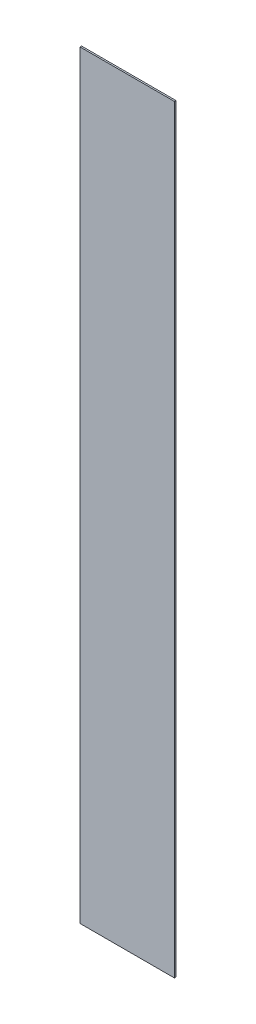
from build123d import *

# Parameters (mm, degrees)
SKETCH1_W           = 600
SKETCH1_H           = 4823
BOSS_EXTRUDE1_DEPTH = 10


with BuildPart() as part:
    # Sketch1 → Boss-Extrude1 (new body)
    with BuildSketch(Plane.XY):
        Rectangle(SKETCH1_W, SKETCH1_H)
    extrude(amount=BOSS_EXTRUDE1_DEPTH)


solid = part.part
